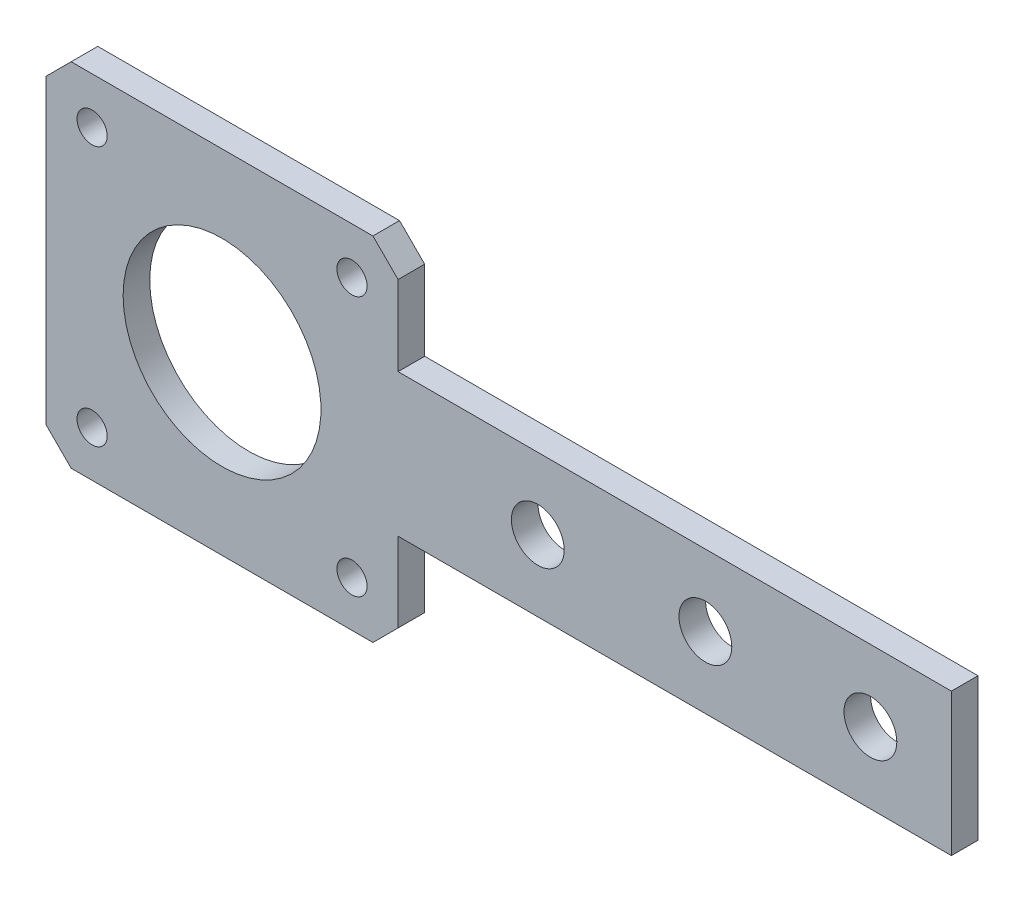
from build123d import *

# Parameters (mm, degrees)
BOSS_EXTRUDE1_DEPTH = 3.175
SKETCH3_R           = 11.8
SKETCH3_R_2         = 1.8
CUT_EXTRUDE1_DEPTH  = 1823.683867823
SKETCH4_R           = 3.15
CUT_EXTRUDE2_DEPTH  = 1823.683867823


with BuildPart() as part:
    # Sketch1 → Boss-Extrude1 (new body)
    with BuildSketch(Plane.XY):
        Polygon((-1010.58632196, 1449.028372115), (-1010.58632196, 1458.511234066), (-944.581241408, 1458.511234066), (-944.581241408, 1475.511234066), (-1010.58632196, 1475.511234066), (-1010.58632196, 1485.028372115), (-1013.58632196, 1488.028372115), (-1049.58632196, 1488.028372115), (-1052.58632196, 1485.028372115), (-1052.58632196, 1449.028372115), (-1049.58632196, 1446.028372115), (-1013.58632196, 1446.028372115), align=None)
    extrude(amount=BOSS_EXTRUDE1_DEPTH)

    # Sketch3 → Cut-Extrude1 (cut, through all)
    with BuildSketch(Plane(origin=(0, 0, 0), x_dir=(-1, 0, 0), z_dir=(0, 0, -1))):
        with Locations((1031.58632196, 1466.994096018)):
            Circle(SKETCH3_R)
        with Locations((1047.08632196, 1482.494096018)):
            Circle(SKETCH3_R_2)
        with Locations((1047.08632196, 1451.494096018)):
            Circle(SKETCH3_R_2)
        with Locations((1016.08632196, 1451.494096018)):
            Circle(SKETCH3_R_2)
        with Locations((1016.08632196, 1482.494096018)):
            Circle(SKETCH3_R_2)
    extrude(amount=-CUT_EXTRUDE1_DEPTH, mode=Mode.SUBTRACT)

    # Sketch4 → Cut-Extrude2 (cut, through all)
    with BuildSketch(Plane.XY.offset(3.175)):
        with Locations((-973.927184785, 1466.986205253)):
            Circle(SKETCH4_R)
        with Locations((-993.918310147, 1466.990315025)):
            Circle(SKETCH4_R)
        with Locations((-954.241393614, 1466.990315025)):
            Circle(SKETCH4_R)
    extrude(amount=-CUT_EXTRUDE2_DEPTH, mode=Mode.SUBTRACT)


solid = part.part
